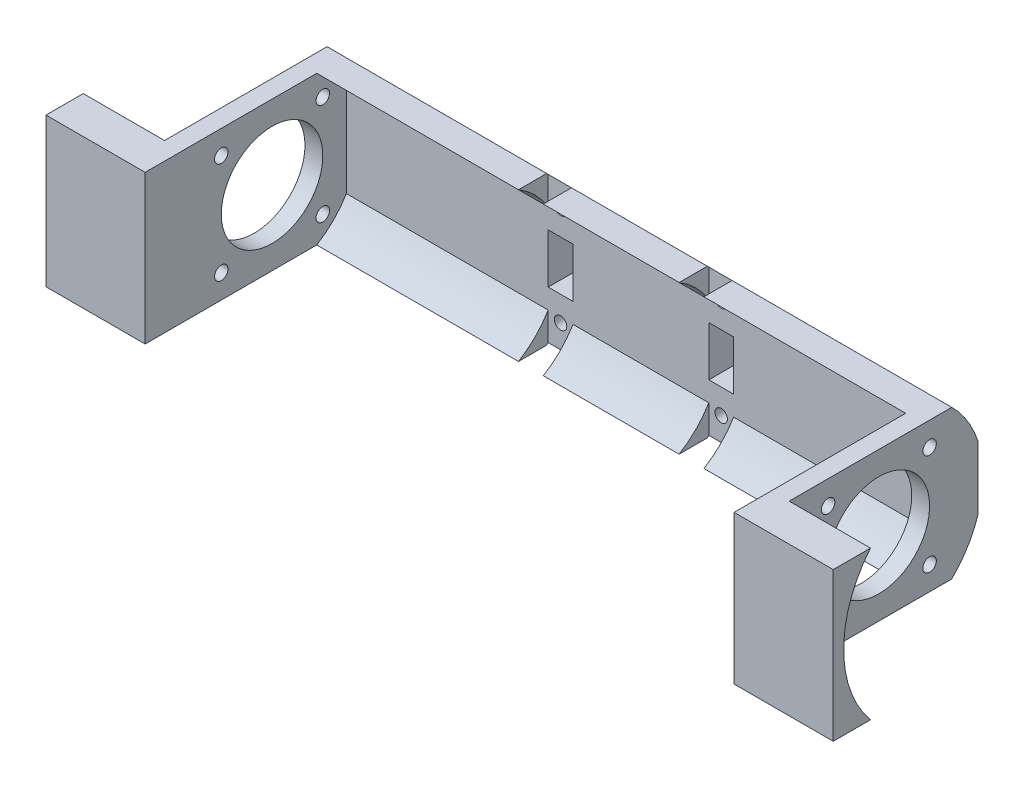
from build123d import *

# Parameters (mm, degrees)
SKETCH3_W               = 20.828
SKETCH3_H               = 6.35
SKETCH3_W_2             = 4.572
SKETCH3_H_2             = 45.212
SKETCH3_W_3             = 150.876
BOSS_EXTRUDE1_DEPTH     = 38.1
SKETCH5_R               = 1.7272
SKETCH5_R_2             = 13
CUT_EXTRUDE2_DEPTH      = 193.753075911
CUT_EXTRUDE3_DEPTH      = 193.753075911
BOSS_EXTRUDE2_DEPTH     = 155.448
CUT_EXTRUDE1_DEPTH      = 120.492895555
CUT_EXTRUDE1_DEPTH_BACK = 120.492895555
SKETCH4_R               = 1.5875
SKETCH8_R               = 29.845
CUT_EXTRUDE4_DEPTH      = 193.75307593
BOSS_EXTRUDE3_DEPTH     = 20.828
SKETCH10_W              = 6.35
SKETCH10_H              = 38.1
CUT_EXTRUDE5_DEPTH      = 120.492895586


with BuildPart() as part:
    # Sketch3 → Boss-Extrude1 (new body)
    with BuildSketch(Plane(origin=(0, 0, 0), x_dir=(1, 0, 0), z_dir=(0, 1, 0))):
        with Locations((-90.424, -51.562)):
            Rectangle(SKETCH3_W, SKETCH3_H)
        with Locations((-77.724, -51.562)):
            Rectangle(SKETCH3_W_2, SKETCH3_H)
        with Locations((-77.724, -25.781)):
            Rectangle(SKETCH3_W_2, SKETCH3_H_2)
        with Locations((-77.724, 0)):
            Rectangle(SKETCH3_W_2, SKETCH3_H)
        Rectangle(SKETCH3_W_3, SKETCH3_H)
        with Locations((77.724, 0)):
            Rectangle(SKETCH3_W_2, SKETCH3_H)
        with Locations((77.724, -25.781)):
            Rectangle(SKETCH3_W_2, SKETCH3_H_2)
        with Locations((77.724, -51.562)):
            Rectangle(SKETCH3_W_2, SKETCH3_H)
        with Locations((90.424, -51.562)):
            Rectangle(SKETCH3_W, SKETCH3_H)
    extrude(amount=BOSS_EXTRUDE1_DEPTH)

    # Sketch5 → Cut-Extrude2 (cut, through all)
    with BuildSketch(Plane.ZY.offset(80.01)):
        with Locations((9.225, 32.05)):
            Circle(SKETCH5_R)
        with Locations((35.225, 32.05)):
            Circle(SKETCH5_R)
        with Locations((35.225, 6.05)):
            Circle(SKETCH5_R)
        with Locations((9.225, 6.05)):
            Circle(SKETCH5_R)
        with Locations((22.225, 19.05)):
            Circle(SKETCH5_R_2)
    extrude(amount=-CUT_EXTRUDE2_DEPTH, mode=Mode.SUBTRACT)

    # Sketch6 → Cut-Extrude3 (cut, through all)
    with BuildSketch(Plane.ZY.offset(80.01)):
        with BuildLine():
            Line((22.225, 45.72), (-24.944215418, 45.72))
            Line((-24.944215418, 45.72), (-24.944215418, -7.62))
            Line((-24.944215418, -7.62), (22.225, -7.62))
            ThreePointArc((22.225, -7.62), (-4.445, 19.05), (22.225, 45.72))
        make_face()
    extrude(amount=-CUT_EXTRUDE3_DEPTH, mode=Mode.SUBTRACT)

    # Sketch7 → Boss-Extrude2 (add)
    with BuildSketch(Plane.ZY.offset(80.01)):
        with BuildLine():
            Line((3.55988816, 38.1), (10.7773747, 38.1))
            ThreePointArc((10.7773747, 38.1), (0, 19.05), (10.7773747, 0))
            Line((10.7773747, 0), (3.55988816, 0))
            ThreePointArc((3.55988816, 0), (-0.473774796, 5.048052894), (-3.175, 10.918032218))
            Line((-3.175, 10.918032218), (-3.175, 27.181967782))
            ThreePointArc((-3.175, 27.181967782), (-0.473774796, 33.051947106), (3.55988816, 38.1))
        make_face()
    extrude(amount=-BOSS_EXTRUDE2_DEPTH)

    # Sketch4 → Cut-Extrude1 (cut, two sides: drawn at the far end of the back side and taken through both)
    with BuildSketch(Plane.XY.offset(3.175).offset(-CUT_EXTRUDE1_DEPTH_BACK)):
        Polygon((17.399, 25.4), (17.399, 19.05), (17.399, 12.7), (23.749, 12.7), (23.749, 25.4), align=None)
        Polygon((-17.399, 25.4), (-23.749, 25.4), (-23.749, 12.7), (-17.399, 12.7), (-17.399, 19.05), align=None)
        with Locations((-20.574, 31.75)):
            Circle(SKETCH4_R)
        with Locations((-20.574, 6.35)):
            Circle(SKETCH4_R)
        with Locations((20.574, 6.35)):
            Circle(SKETCH4_R)
        with Locations((20.574, 31.75)):
            Circle(SKETCH4_R)
    extrude(amount=CUT_EXTRUDE1_DEPTH + CUT_EXTRUDE1_DEPTH_BACK, mode=Mode.SUBTRACT)

    # Sketch8 → Cut-Extrude4 (cut, through all)
    with BuildSketch(Plane.ZY.offset(80.01)):
        with Locations((22.225, 19.05)):
            Circle(SKETCH8_R)
    cut_extrude4 = extrude(amount=CUT_EXTRUDE4_DEPTH, mode=Mode.SUBTRACT)

    # Sketch9 → Boss-Extrude3 (add)
    with BuildSketch(Plane.ZY.offset(80.01)):
        with BuildLine():
            Line((48.387, 38.1), (48.387, 33.412234541))
            ThreePointArc((48.387, 33.412234541), (46.904737017, 35.831972642), (45.199366694, 38.1))
            Line((45.199366694, 38.1), (48.387, 38.1))
        make_face()
        with BuildLine():
            Line((48.387, 0), (48.387, 4.687765459))
            ThreePointArc((48.387, 4.687765459), (46.904737017, 2.268027358), (45.199366694, 0))
            Line((45.199366694, 0), (48.387, 0))
        make_face()
    boss_extrude3 = extrude(amount=BOSS_EXTRUDE3_DEPTH)

    # Mirror4: Cut-Extrude4, Boss-Extrude3 across plane
    add(cut_extrude4.mirror(Plane(origin=(0, 0, 0), x_dir=(0, 0, 1), z_dir=(1, 0, 0))), mode=Mode.SUBTRACT)
    add(boss_extrude3.mirror(Plane(origin=(0, 0, 0), x_dir=(0, 0, 1), z_dir=(1, 0, 0))))

    # Sketch10 → Cut-Extrude5 (cut, through all)
    with BuildSketch(Plane.XY.offset(3.175)):
        with Locations((-20.574, 19.05)):
            Rectangle(SKETCH10_W, SKETCH10_H)
        with Locations((20.574, 19.05)):
            Rectangle(SKETCH10_W, SKETCH10_H)
    extrude(amount=CUT_EXTRUDE5_DEPTH, mode=Mode.SUBTRACT)


solid = part.part
